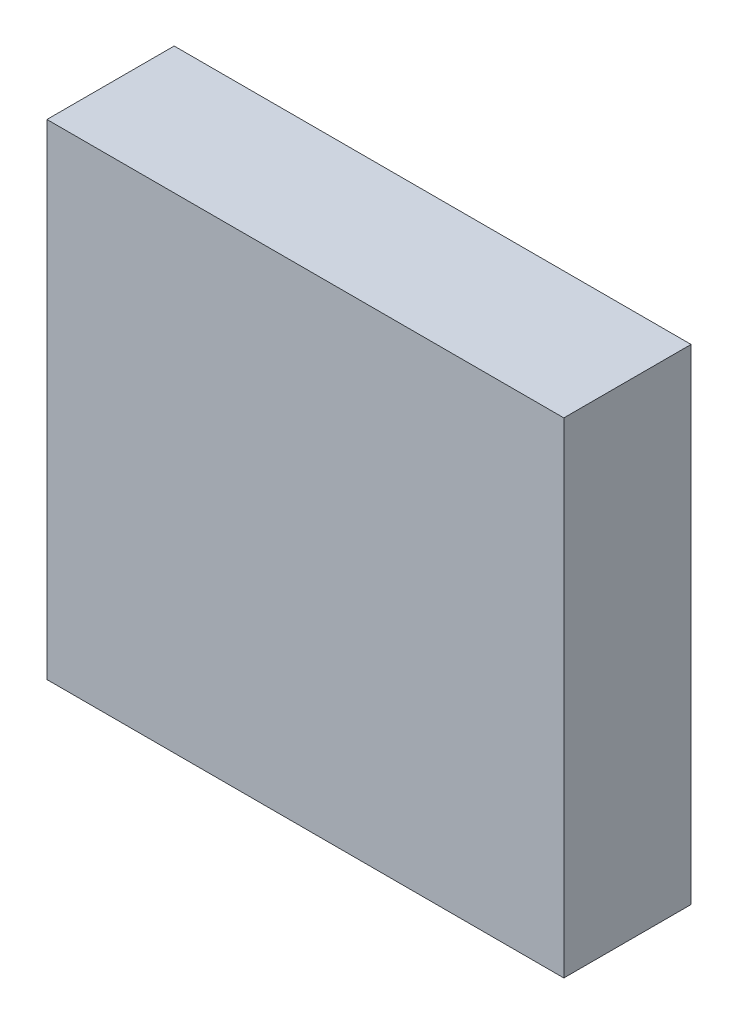
from build123d import *

# Parameters (mm, degrees)
SKETCH_1_W      = 3.25
SKETCH_1_H      = 3.05
EXTRUDE_1_DEPTH = 0.8


with BuildPart() as part:
    # 草图1 → 凸台-拉伸1 (new body)
    with BuildSketch(Plane.XY):
        Rectangle(SKETCH_1_W, SKETCH_1_H)
    extrude(amount=EXTRUDE_1_DEPTH)


solid = part.part
